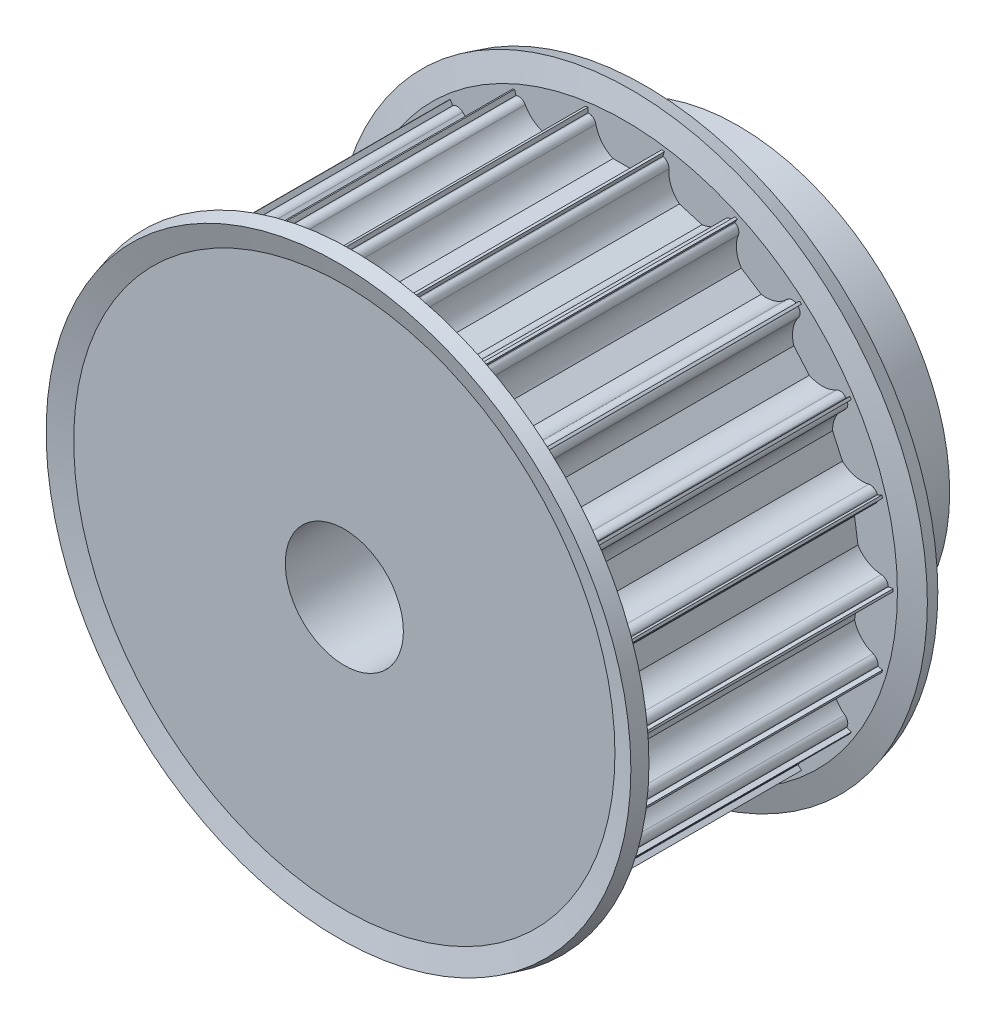
from build123d import *

# Parameters (mm, degrees)
CUT_EXTRUDE4_DEPTH = 35
CIRPATTERN1_COUNT  = 22


with BuildPart() as part:
    # Sketch1 → Revolve1 (revolve)
    with BuildSketch(Plane(origin=(0, 0, 0), x_dir=(0, 0, -1), z_dir=(1, 0, 0)), mode=Mode.PRIVATE) as revolve1_sk:
        Polygon((0, 6), (0, 27.25), (30, 27.25), (30, 21.5), (40, 21.5), (40, 6), align=None)
    revolve(revolve1_sk.sketch.rotate(Axis((0, 0, 111.06978123), (0, 0, -1)), 90), axis=Axis((0, 0, 111.06978123), (0, 0, -1)))

    # Sketch6 → Cut-Extrude4 (cut)
    with BuildSketch(Plane.XY):
        with BuildLine():
            Line((3.674234614, 26.5), (3.75, 26.5))
            Line((3.75, 26.5), (3.75, 28.5))
            Line((3.75, 28.5), (-3.75, 28.5))
            Line((-3.75, 28.5), (-3.75, 26.5))
            Line((-3.75, 26.5), (-3.674234614, 26.5))
            ThreePointArc((-3.674234614, 26.5), (-3.199892965, 26.330947502), (-2.939387691, 25.9))
            ThreePointArc((-2.939387691, 25.9), (-2.331759211, 24.612435701), (-1.198957881, 23.75))
            Line((-1.198957881, 23.75), (1.198957881, 23.75))
            ThreePointArc((1.198957881, 23.75), (2.331759211, 24.612435701), (2.939387691, 25.9))
            ThreePointArc((2.939387691, 25.9), (3.199892965, 26.330947502), (3.674234614, 26.5))
        make_face()
    cut_extrude4 = extrude(amount=-CUT_EXTRUDE4_DEPTH, mode=Mode.SUBTRACT)

    # CirPattern1: Cut-Extrude4 ×22 about axis
    cirpattern1_axis = Axis((0, 0, 0), (0, 0, 1))
    for i in range(1, CIRPATTERN1_COUNT):
        add(cut_extrude4.rotate(cirpattern1_axis, i * 360 / CIRPATTERN1_COUNT), mode=Mode.SUBTRACT)

    # Sketch7 → Revolve2 (revolve)
    with BuildSketch(Plane(origin=(0, 0, 0), x_dir=(0, 0, -1), z_dir=(1, 0, 0)), mode=Mode.PRIVATE) as revolve2_sk:
        Polygon((0, 27.493260406), (0, 22.690739153), (1.5, 22.690739153), (1.5, 27.690739153), (0.856921938, 30.090739153), (-0.591966801, 29.702510585), align=None)
        Polygon((30.591966801, 29.702510585), (29.143078062, 30.090739153), (28.5, 27.690739153), (28.5, 22.690739153), (30, 22.690739153), (30, 27.493260406), align=None)
    revolve(revolve2_sk.sketch.rotate(Axis((0, 0, 111.06978123), (0, 0, -1)), 90), axis=Axis((0, 0, 111.06978123), (0, 0, -1)))


solid = part.part
